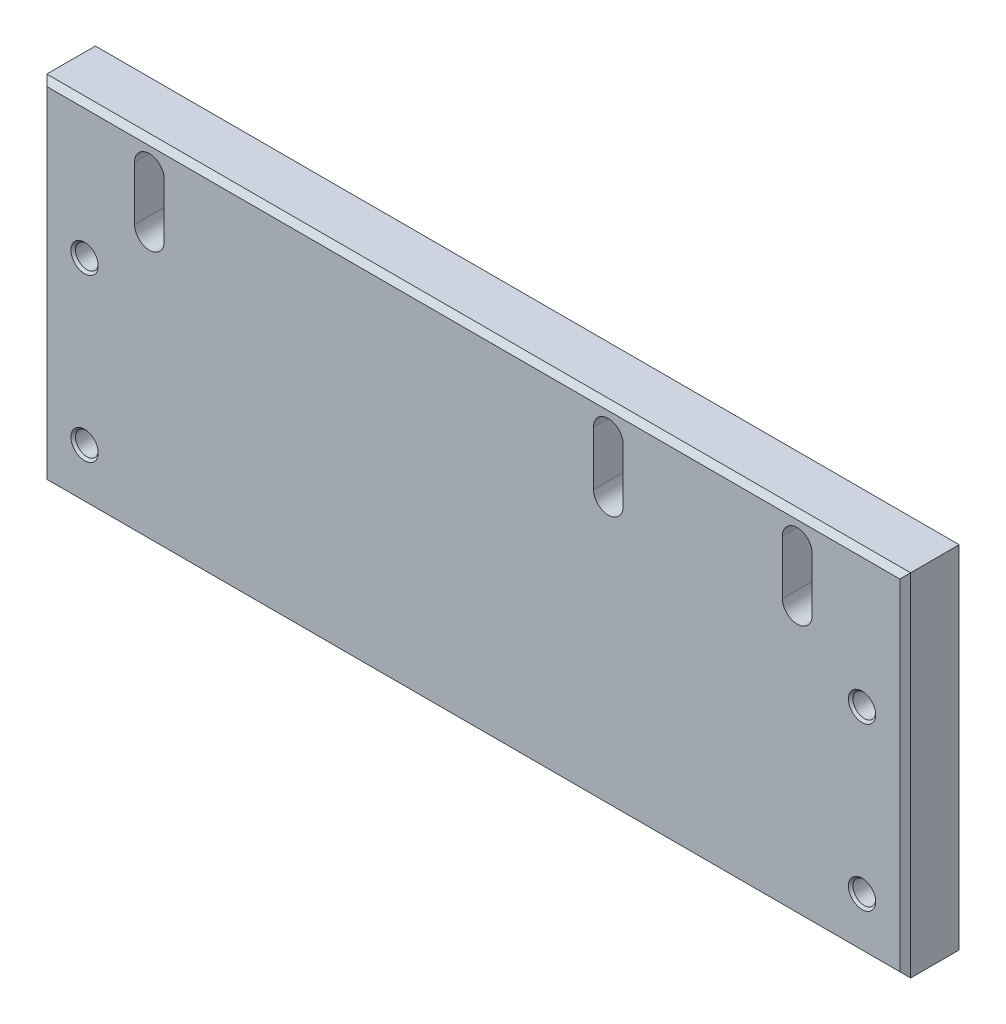
from build123d import *

# Parameters (mm, degrees)
SKIZZE1_W                       = 160
SKIZZE1_H                       = 65
AUFSATZ_LINEAR_AUSTRAGEN1_DEPTH = 10
M5_GEWINDEBOHRUNG1_D            = 4.2
M5_GEWINDEBOHRUNG1_DEPTH        = 14
M5_GEWINDEBOHRUNG1_CSINK_D      = 5.05
M5_GEWINDEBOHRUNG1_CSINK_ANGLE  = 90
M5_GEWINDEBOHRUNG1_TIP          = 1.2618073
SCHNITT_LINEAR_AUSTRAGEN1_DEPTH = 87.926693254
FASE1_SIZE                      = 1


with BuildPart() as part:
    # Skizze1 → Aufsatz-Linear austragen1 (new body)
    with BuildSketch(Plane.XY):
        Rectangle(SKIZZE1_W, SKIZZE1_H)
    extrude(amount=AUFSATZ_LINEAR_AUSTRAGEN1_DEPTH)

    # M5 Gewindebohrung1
    with Locations(Plane.XY.offset(10)):
        with Locations((-72, 7.5), (-72, -22.5), (72, -22.5), (72, 7.5)):
            CounterSinkHole(M5_GEWINDEBOHRUNG1_D / 2, M5_GEWINDEBOHRUNG1_CSINK_D / 2, depth=M5_GEWINDEBOHRUNG1_DEPTH, counter_sink_angle=M5_GEWINDEBOHRUNG1_CSINK_ANGLE)
            with Locations((0, 0, -(M5_GEWINDEBOHRUNG1_DEPTH + M5_GEWINDEBOHRUNG1_TIP / 2))):  # 118° drill point
                Cone(0, M5_GEWINDEBOHRUNG1_D / 2, M5_GEWINDEBOHRUNG1_TIP, mode=Mode.SUBTRACT)

    # Skizze4 → Schnitt-Linear austragen1 (cut, through all)
    with BuildSketch(Plane.XY.offset(10)):
        with BuildLine():
            Line((27.75, 27.5), (27.75, 17.5))
            ThreePointArc((27.75, 17.5), (25, 14.75), (22.25, 17.5))
            Line((22.25, 17.5), (22.25, 27.5))
            ThreePointArc((22.25, 27.5), (25, 30.25), (27.75, 27.5))
        make_face()
        with BuildLine():
            Line((57.25, 17.5), (57.25, 27.5))
            ThreePointArc((57.25, 27.5), (60, 30.25), (62.75, 27.5))
            Line((62.75, 27.5), (62.75, 17.5))
            ThreePointArc((62.75, 17.5), (60, 14.75), (57.25, 17.5))
        make_face()
        with BuildLine():
            Line((-57.25, 17.5), (-57.25, 27.5))
            ThreePointArc((-57.25, 27.5), (-60, 30.25), (-62.75, 27.5))
            Line((-62.75, 27.5), (-62.75, 17.5))
            ThreePointArc((-62.75, 17.5), (-60, 14.75), (-57.25, 17.5))
        make_face()
    extrude(amount=-SCHNITT_LINEAR_AUSTRAGEN1_DEPTH, mode=Mode.SUBTRACT)

    # Fase1
    fase1_edges = [part.edges().sort_by_distance(p)[0] for p in [
        (80, 0, 10),
        (0, 32.5, 10),
        (-80, 0, 10),
        (0, -32.5, 10),
    ]]
    chamfer(fase1_edges, length=FASE1_SIZE)


solid = part.part
